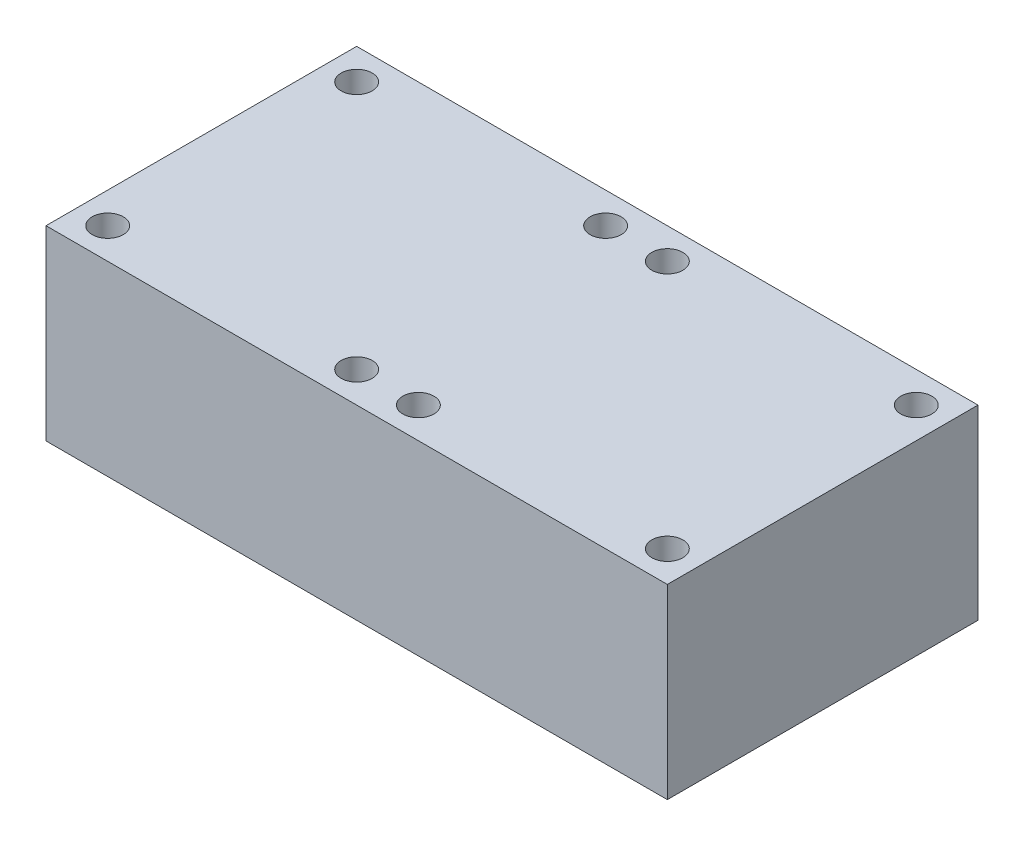
from build123d import *

# Parameters (mm, degrees)
SKETCH_1_W          = 60
SKETCH_1_H          = 30
EXTRUDE_1_DEPTH     = 30
SKETCH_2_W          = 60
SKETCH_2_H          = 30
CUT_EXTRUDE_1_DEPTH = 12
SKETCH_3_R          = 1.5
CUT_EXTRUDE_2_DEPTH = 47.086874487


with BuildPart() as part:
    # 草图1 → 凸台-拉伸1 (new body)
    with BuildSketch(Plane.XY):
        Rectangle(SKETCH_1_W, SKETCH_1_H)
    extrude(amount=EXTRUDE_1_DEPTH)

    # 草图2 → 切除-拉伸1 (cut)
    with BuildSketch(Plane.XZ.offset(15)):
        with Locations((0, 15)):
            Rectangle(SKETCH_2_W, SKETCH_2_H)
    extrude(amount=-CUT_EXTRUDE_1_DEPTH, mode=Mode.SUBTRACT)

    # 草图3 → 切除-拉伸2 (cut, through all)
    with BuildSketch(Plane(origin=(0, 15, 0), x_dir=(1, 0, 0), z_dir=(0, 1, 0))):
        with Locations(Location((-27.02081528, -2.97918472, 0), (0, 0, 270))):
            Circle(SKETCH_3_R)
        with Locations(Location((-2.97918472, -2.97918472, 0), (0, 0, 270))):
            Circle(SKETCH_3_R)
        with Locations(Location((-2.97918472, -27.02081528, 0), (0, 0, 270))):
            Circle(SKETCH_3_R)
        with Locations(Location((-27.02081528, -27.02081528, 0), (0, 0, 270))):
            Circle(SKETCH_3_R)
        with Locations(Location((27.02081528, -27.02081528, 0), (0, 0, 90))):
            Circle(SKETCH_3_R)
        with Locations(Location((2.97918472, -27.02081528, 0), (0, 0, 90))):
            Circle(SKETCH_3_R)
        with Locations(Location((2.97918472, -2.97918472, 0), (0, 0, 90))):
            Circle(SKETCH_3_R)
        with Locations(Location((27.02081528, -2.97918472, 0), (0, 0, 90))):
            Circle(SKETCH_3_R)
    extrude(amount=-CUT_EXTRUDE_2_DEPTH, mode=Mode.SUBTRACT)


solid = part.part
